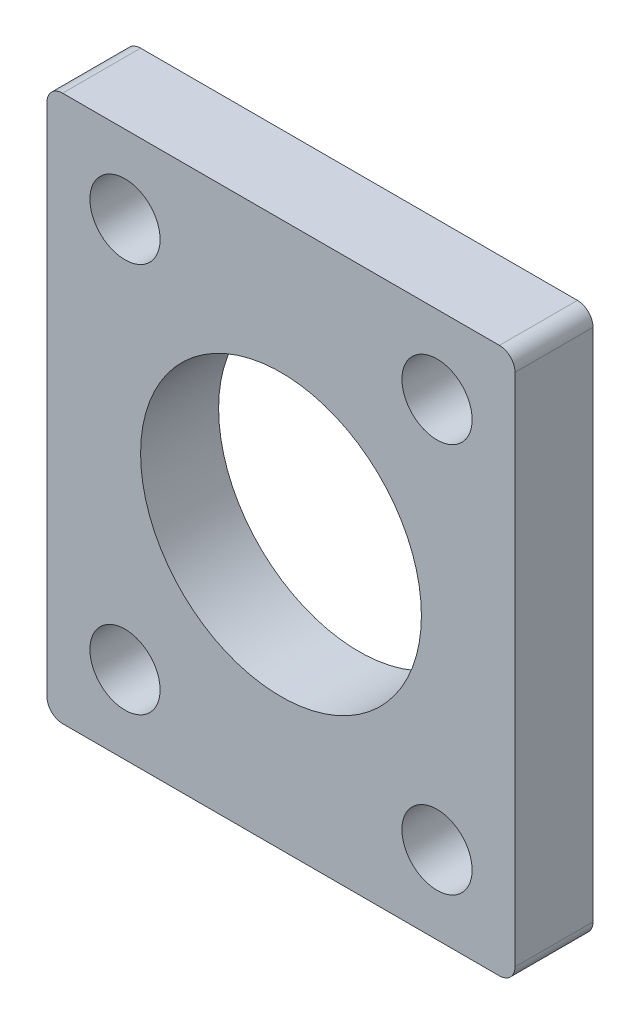
from build123d import *

# Parameters (mm, degrees)
SKETCH1_W           = 60
SKETCH1_H           = 70
SKETCH1_R           = 18
BOSS_EXTRUDE1_DEPTH = 10
FILLET1_R           = 2
SKETCH3_R           = 4.5
CUT_EXTRUDE2_DEPTH  = 100


with BuildPart() as part:
    # Sketch1 → Boss-Extrude1 (new body)
    with BuildSketch(Plane.XY):
        Rectangle(SKETCH1_W, SKETCH1_H)
        Circle(SKETCH1_R, mode=Mode.SUBTRACT)
    extrude(amount=BOSS_EXTRUDE1_DEPTH)

    # Fillet1
    fillet1_edges = [part.edges().sort_by_distance(p)[0] for p in [
        (-30, -35, 5),
        (-30, 35, 5),
        (30, 35, 5),
        (30, -35, 5),
    ]]
    fillet(fillet1_edges, radius=FILLET1_R)

    # Sketch3 → Cut-Extrude2 (cut)
    with BuildSketch(Plane(origin=(-387.472155748, 43.575337974, 11), x_dir=(-1, 0, 0), z_dir=(0, 0, -1))):
        with Locations(Location((-407.472155748, -68.575337974, 0), (0, 0, 180))):
            Circle(SKETCH3_R)
        with Locations(Location((-367.472155748, -68.575337974, 0), (0, 0, 180))):
            Circle(SKETCH3_R)
        with Locations(Location((-367.472155748, -18.575337974, 0), (0, 0, 180))):
            Circle(SKETCH3_R)
        with Locations(Location((-407.472155748, -18.575337974, 0), (0, 0, 180))):
            Circle(SKETCH3_R)
    extrude(amount=CUT_EXTRUDE2_DEPTH, mode=Mode.SUBTRACT)


solid = part.part
